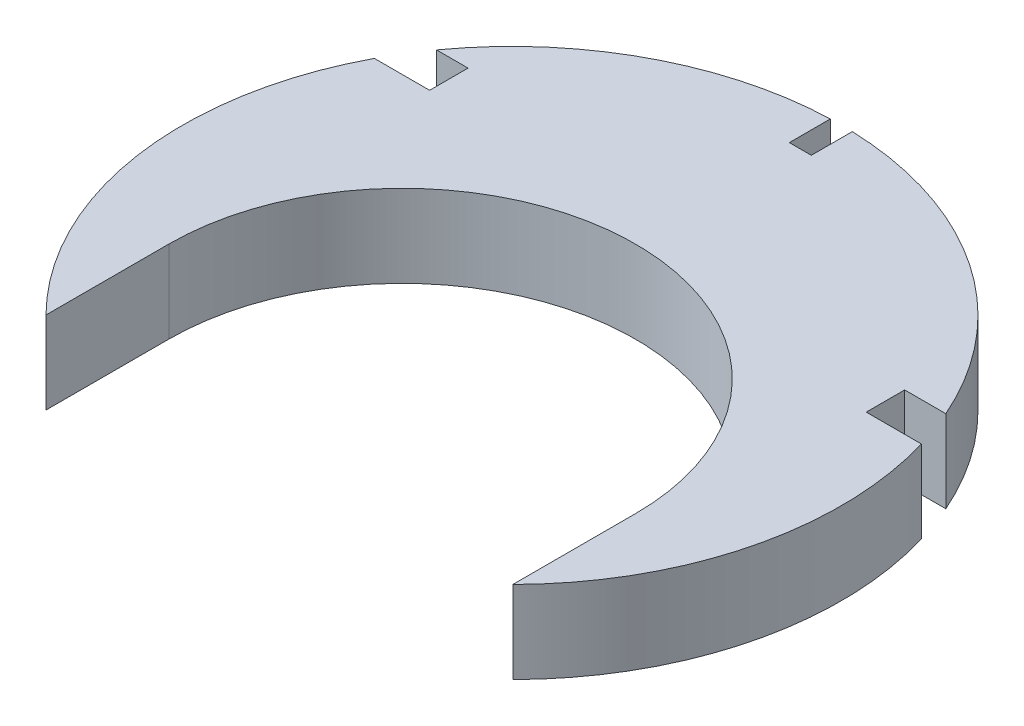
from build123d import *

# Parameters (mm, degrees)
BOSS_EXTRUDE1_DEPTH = 3


with BuildPart() as part:
    # Sketch1 → Boss-Extrude1 (new body)
    with BuildSketch(Plane(origin=(0, 3.6, 0), x_dir=(1, 0, 0), z_dir=(0, 1, 0))):
        with BuildLine():
            Line((-8.6, 7), (-8.6, 5.6))
            Line((-8.6, 5.6), (-10.613199329, 5.6))
            ThreePointArc((-10.613199329, 5.6), (-11.866912034, -1.782245428), (-8.5, -8.470537173))
            Line((-8.5, -8.470537173), (-8.5, -4))
            ThreePointArc((-8.5, -4), (0, 4.5), (8.5, -4))
            Line((8.5, -4), (8.5, -8.470537173))
            ThreePointArc((8.5, -8.470537173), (11.632283064, -2.947879019), (11.508257905, 3.4))
            Line((11.508257905, 3.4), (9.5, 3.4))
            Line((9.5, 3.4), (9.5, 4.8))
            Line((9.5, 4.8), (10.998181668, 4.8))
            ThreePointArc((10.998181668, 4.8), (6.985647075, 9.757086397), (1, 11.958260743))
            Line((1, 11.958260743), (1, 10.5))
            Line((1, 10.5), (0.4, 10.5))
            Line((0.4, 10.5), (-0.4, 10.5))
            Line((-0.4, 10.5), (-0.4, 11.99333148))
            ThreePointArc((-0.4, 11.99333148), (-5.654440617, 10.584295031), (-9.746794345, 7))
            Line((-9.746794345, 7), (-8.6, 7))
        make_face()
        with BuildLine():
            Line((0.4, 11.99333148), (0.4, 10.5))
            Line((0.4, 10.5), (1, 10.5))
            Line((1, 10.5), (1, 11.958260743))
            ThreePointArc((1, 11.958260743), (0.700219601, 11.979553101), (0.4, 11.99333148))
        make_face()
    extrude(amount=BOSS_EXTRUDE1_DEPTH)


solid = part.part
